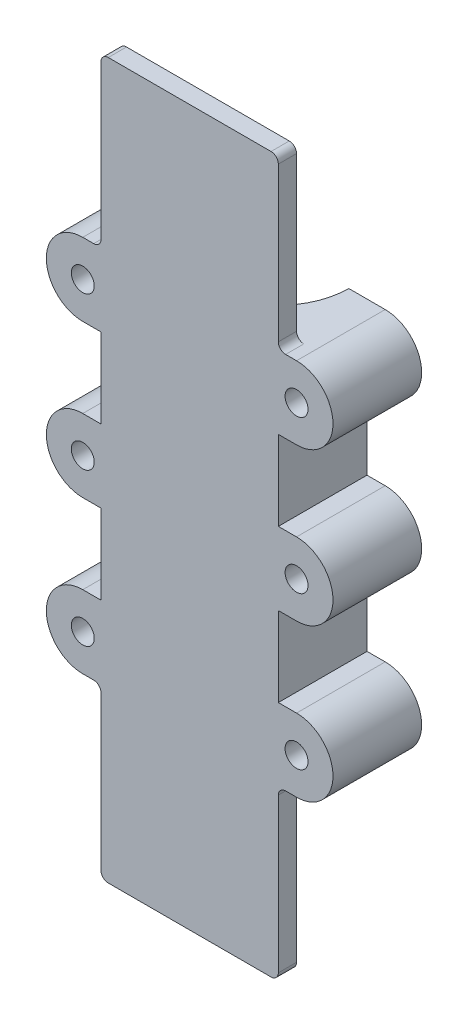
from build123d import *

# Parameters (mm, degrees)
BOSS_EXTRUDE1_DEPTH = 65.8876
BOSS_EXTRUDE2_DEPTH = 29.3624
SKETCH4_R           = 2
BOSS_EXTRUDE3_DEPTH = 15.4559
FILLET1_R           = 1.27


with BuildPart() as part:
    # Sketch1 → Boss-Extrude1 (new body)
    with BuildSketch(Plane(origin=(0, 0, 0), x_dir=(1, 0, 0), z_dir=(0, 1, 0))):
        with BuildLine():
            Line((-12.2809, 0), (-15.4559, 0))
            Line((-15.4559, 0), (-15.4559, -15.4559))
            Line((-15.4559, -15.4559), (0, -15.4559))
            Line((0, -15.4559), (15.4559, -15.4559))
            Line((15.4559, -15.4559), (15.4559, 0))
            Line((15.4559, 0), (12.2809, 0))
            ThreePointArc((12.2809, 0), (0, -12.2809), (-12.2809, 0))
        make_face()
    extrude(amount=BOSS_EXTRUDE1_DEPTH)

    # Sketch2 → Boss-Extrude2 (add)
    with BuildSketch(Plane(origin=(0, 65.8876, 0), x_dir=(1, 0, 0), z_dir=(0, 1, 0))):
        Polygon((-12.2809, -12.2809), (0, -12.2809), (12.2809, -12.2809), (15.4559, -12.2809), (15.4559, -15.4559), (-15.4559, -15.4559), (-15.4559, -12.2809), align=None)
    boss_extrude2 = extrude(amount=BOSS_EXTRUDE2_DEPTH)

    # Mirror1: Boss-Extrude2 across plane
    add(boss_extrude2.mirror(Plane.ZX.offset(32.9438)))

    # Sketch4 → Boss-Extrude3 (add, through all)
    # profile 1 of 6: a face of its own
    with BuildSketch(Plane(origin=(0, 0, 0), x_dir=(-1, 0, 0), z_dir=(0, 0, -1))):
        with BuildLine():
            Line((-15.4559, 39.2938), (-15.4559, 26.5938))
            Line((-15.4559, 26.5938), (-18.6309, 26.5938))
            ThreePointArc((-18.6309, 26.5938), (-24.9809, 32.9438), (-18.6309, 39.2938))
            Line((-18.6309, 39.2938), (-15.4559, 39.2938))
        make_face()
        with Locations((-18.6309, 32.9438)):
            Circle(SKETCH4_R, mode=Mode.SUBTRACT)
    # profile 2 of 6: a face of its own
    with BuildSketch(Plane(origin=(0, 0, 0), x_dir=(-1, 0, 0), z_dir=(0, 0, -1))):
        with BuildLine():
            Line((-15.4559, 12.7), (-18.6309, 12.7))
            ThreePointArc((-18.6309, 12.7), (-24.9809, 6.35), (-18.6309, 0))
            Line((-18.6309, 0), (-15.4559, 0))
            Line((-15.4559, 0), (-15.4559, 12.7))
        make_face()
        with Locations(Location((-18.6309, 6.35, 0), (0, 0, 180))):
            Circle(SKETCH4_R, mode=Mode.SUBTRACT)
    # profile 3 of 6: a face of its own
    with BuildSketch(Plane(origin=(0, 0, 0), x_dir=(-1, 0, 0), z_dir=(0, 0, -1))):
        with BuildLine():
            Line((-18.6309, 65.8876), (-15.4559, 65.8876))
            Line((-15.4559, 65.8876), (-15.4559, 53.1876))
            Line((-15.4559, 53.1876), (-18.6309, 53.1876))
            ThreePointArc((-18.6309, 53.1876), (-24.9809, 59.5376), (-18.6309, 65.8876))
        make_face()
        with Locations((-18.6309, 59.5376)):
            Circle(SKETCH4_R, mode=Mode.SUBTRACT)
    # profile 4 of 6: a face of its own
    with BuildSketch(Plane(origin=(0, 0, 0), x_dir=(-1, 0, 0), z_dir=(0, 0, -1))):
        with BuildLine():
            Line((18.6309, 0), (15.4559, 0))
            Line((15.4559, 0), (15.4559, 12.7))
            Line((15.4559, 12.7), (18.6309, 12.7))
            ThreePointArc((18.6309, 12.7), (24.9809, 6.35), (18.6309, 0))
        make_face()
        with Locations((18.6309, 6.35)):
            Circle(SKETCH4_R, mode=Mode.SUBTRACT)
    # profile 5 of 6: a face of its own
    with BuildSketch(Plane(origin=(0, 0, 0), x_dir=(-1, 0, 0), z_dir=(0, 0, -1))):
        with BuildLine():
            Line((15.4559, 53.1876), (18.6309, 53.1876))
            ThreePointArc((18.6309, 53.1876), (24.9809, 59.5376), (18.6309, 65.8876))
            Line((18.6309, 65.8876), (15.4559, 65.8876))
            Line((15.4559, 65.8876), (15.4559, 53.1876))
        make_face()
        with Locations(Location((18.6309, 59.5376, 0), (0, 0, 180))):
            Circle(SKETCH4_R, mode=Mode.SUBTRACT)
    # profile 6 of 6: a face of its own
    with BuildSketch(Plane(origin=(0, 0, 0), x_dir=(-1, 0, 0), z_dir=(0, 0, -1))):
        with BuildLine():
            Line((18.6309, 26.5938), (15.4559, 26.5938))
            Line((15.4559, 26.5938), (15.4559, 39.2938))
            Line((15.4559, 39.2938), (18.6309, 39.2938))
            ThreePointArc((18.6309, 39.2938), (24.9809, 32.9438), (18.6309, 26.5938))
        make_face()
        with Locations(Location((18.6309, 32.9438, 0), (0, 0, 180))):
            Circle(SKETCH4_R, mode=Mode.SUBTRACT)
    extrude(amount=-BOSS_EXTRUDE3_DEPTH)

    # Fillet1
    fillet1_edges = [part.edges().sort_by_distance(p)[0] for p in [
        (-15.4559, 0, 13.8684),
        (-15.4559, 95.25, 13.8684),
        (15.4559, 95.25, 13.8684),
        (15.4559, -29.3624, 13.8684),
        (-15.4559, -29.3624, 13.8684),
        (15.4559, 65.8876, 13.8684),
        (15.4559, 0, 13.8684),
        (-15.4559, 65.8876, 13.8684),
    ]]
    fillet(fillet1_edges, radius=FILLET1_R)


solid = part.part
